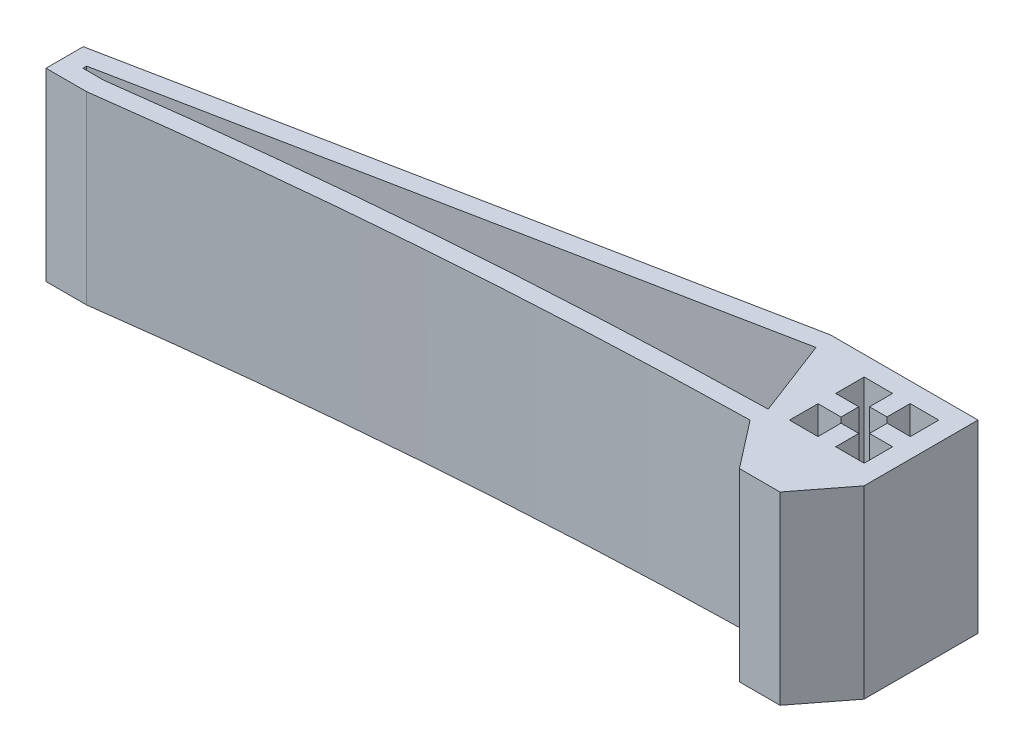
from build123d import *

# Parameters (mm, degrees)
BOSS_EXTRU_1_DEPTH = 50


with BuildPart() as part:
    # Esquisse1 → Boss.-Extru.1 (new body)
    with BuildSketch(Plane(origin=(0, 0, 0), x_dir=(1, 0, 0), z_dir=(0, 1, 0))):
        with BuildLine():
            Line((15.419133563, -15.419133563), (15.419133563, 15.419133563))
            Line((15.419133563, 15.419133563), (-15.419133563, 15.419133563))
            Line((-15.419133563, 15.419133563), (-24.494437672, 15.419133563))
            Line((-24.494437672, 15.419133563), (-193.160150167, -18.138198396))
            Line((-193.160150167, -18.138198396), (-193.160150167, -28.234642357))
            Line((-193.160150167, -28.234642357), (-182.185114876, -28.234642357))
            add(Edge.make_bspline(
                [(-182.185114876, -28.234642357), (-99.136016822, -17.08659502), (-15.419133563, -15.419133563)],
                knots=[0, 0, 0, 1, 1, 1], degree=2))
            Line((-15.419133563, -15.419133563), (-5.487517645, -28.234642357))
            Line((-5.487517645, -28.234642357), (5.487517645, -28.234642357))
            Line((5.487517645, -28.234642357), (15.419133563, -15.419133563))
        make_face()
        Polygon((-10.073577327, 10.1), (-2.373577327, 10.1), (-2.373577327, 3.85), (2.373577327, 3.85), (2.373577327, 10.1), (10.126422673, 10.1), (10.126422673, 2.4), (3.876422673, 2.4), (3.876422673, -2.4), (10.126422673, -2.4), (10.126422673, -10.1), (2.426422673, -10.1), (2.426422673, -3.85), (-2.373577327, -3.85), (-2.373577327, -10.1), (-10.073577327, -10.1), (-10.073577327, -2.4), (-3.823577327, -2.4), (-3.823577327, 2.4), (-10.073577327, 2.4), align=None, mode=Mode.SUBTRACT)
        with BuildLine():
            Line((-23.518772506, 10.515249645), (-188.160150167, -22.241410157))
            Line((-188.160150167, -22.241410157), (-188.160150167, -23.234642357))
            Line((-188.160150167, -23.234642357), (-182.518919813, -23.234642357))
            add(Edge.make_bspline(
                [(-182.518919813, -23.234642357), (-99.352804626, -12.089945504), (-15.518703132, -10.420125071)],
                knots=[0.001988478, 0.001988478, 0.001988478, 1, 1, 1], degree=2))
            Line((-15.518703132, -10.420125071), (-23.518772506, 10.515249645))
        make_face(mode=Mode.SUBTRACT)
    extrude(amount=BOSS_EXTRU_1_DEPTH)


solid = part.part
